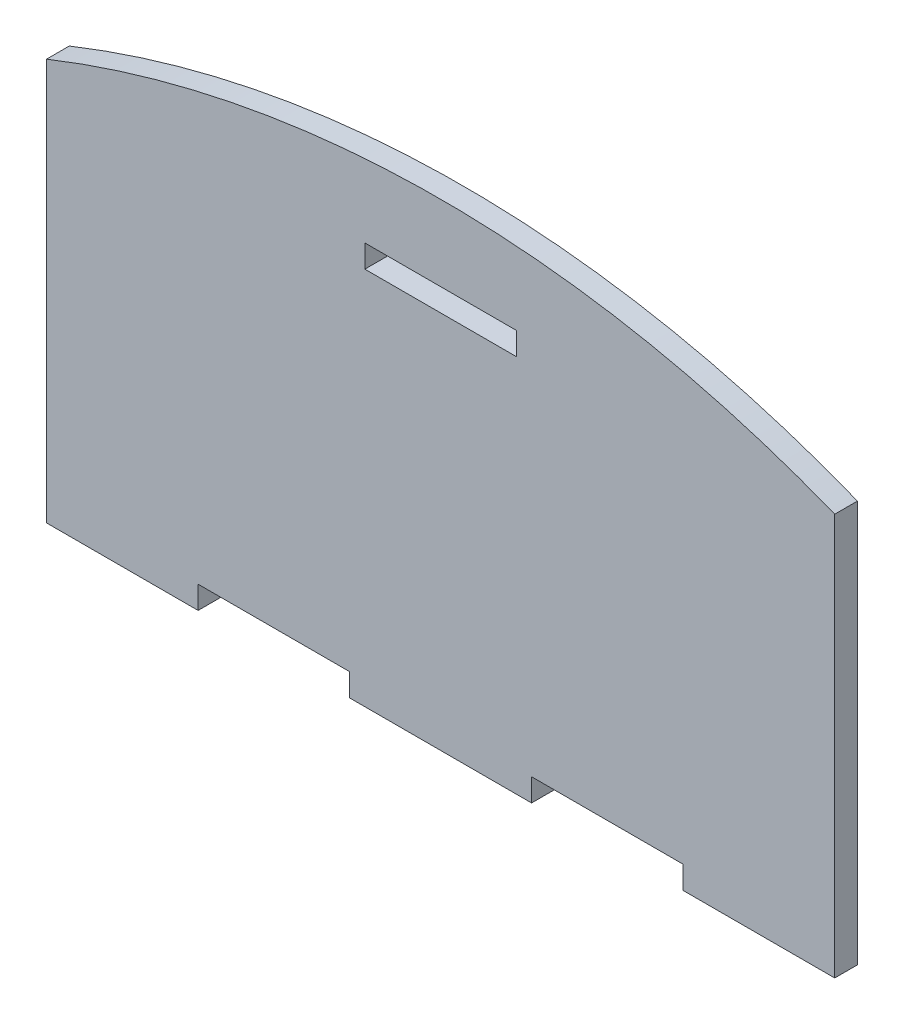
from build123d import *

# Parameters (mm, degrees)
SKETCH1_W           = 20
SKETCH1_H           = 3
BOSS_EXTRUDE1_DEPTH = 3


with BuildPart() as part:
    # Sketch1 → Boss-Extrude1 (new body)
    with BuildSketch(Plane.XY):
        with BuildLine():
            Line((-9.242159986, -25.403689193), (-9.242159986, -22.403689193))
            Line((-9.242159986, -22.403689193), (10.757840014, -22.403689193))
            Line((10.757840014, -22.403689193), (10.757840014, -25.403689193))
            Line((10.757840014, -25.403689193), (34.757840014, -25.403689193))
            Line((34.757840014, -25.403689193), (34.757840014, -22.403689193))
            Line((34.757840014, -22.403689193), (54.757840014, -22.403689193))
            Line((54.757840014, -22.403689193), (54.757840014, -25.403689193))
            Line((54.757840014, -25.403689193), (74.757840014, -25.403689193))
            Line((74.757840014, -25.403689193), (74.757840014, 27.596310807))
            ThreePointArc((74.757840014, 27.596310807), (22.757840014, 37.596310807), (-29.242159986, 27.596310807))
            Line((-29.242159986, 27.596310807), (-29.242159986, -25.403689193))
            Line((-29.242159986, -25.403689193), (-9.242159986, -25.403689193))
        make_face()
        with Locations((22.757840014, 26.096310807)):
            Rectangle(SKETCH1_W, SKETCH1_H, mode=Mode.SUBTRACT)
    extrude(amount=BOSS_EXTRUDE1_DEPTH)


solid = part.part
